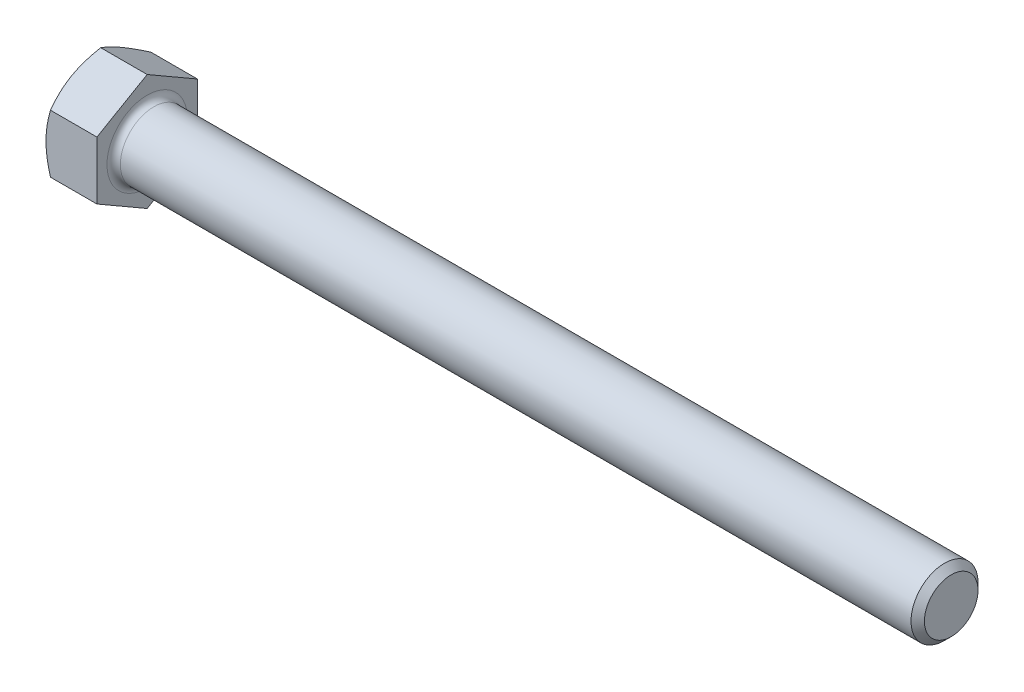
from build123d import *

# Parameters (mm, degrees)
SKETCH1_W      = 76.2
SKETCH1_H      = 3.175
HEAD_DEPTH     = 4.826
CHAMFER2_SIZE  = 0.635
CHAMFER2_SIZE2 = 0.6351
FILLET_2_R     = 0.635


with BuildPart() as part:
    # Sketch1 → Body (revolve)
    with BuildSketch(Plane.XY):
        with Locations((38.1, 1.5875)):
            Rectangle(SKETCH1_W, SKETCH1_H)
    revolve(axis=Axis((76.2, 0, 0), (-1, 0, 0)))

    # Sketch2 → Head (add)
    with BuildSketch(Plane.ZY):
        Polygon((0, 5.499261314), (4.7625, 2.749630657), (4.7625, -2.749630657), (0, -5.499261314), (-4.7625, -2.749630657), (-4.7625, 2.749630657), align=None)
    extrude(amount=HEAD_DEPTH)

    # Sketch3 → Thread (revolve, cut)
    with BuildSketch(Plane.XY):
        Polygon((-4.826, 4.7625), (-4.276073869, 5.715), (-4.826, 5.715), align=None)
    revolve(axis=Axis((-1.1, 0, 0), (1, 0, 0)), mode=Mode.SUBTRACT)

    # Chamfer2
    chamfer2_edges = [part.edges().sort_by_distance(p)[0] for p in [
        (76.2, -3.175, 0),
    ]]
    chamfer2_side = [part.faces().sort_by_distance(p)[0] for p in [
        (38.1, -3.175, 0),
    ]]
    chamfer(chamfer2_edges, length=CHAMFER2_SIZE, length2=CHAMFER2_SIZE2, reference=chamfer2_side[0])

    # Fillet 2
    fillet_2_edges = [part.edges().sort_by_distance(p)[0] for p in [
        (0, -3.175, 0),
    ]]
    fillet(fillet_2_edges, radius=FILLET_2_R)


solid = part.part
